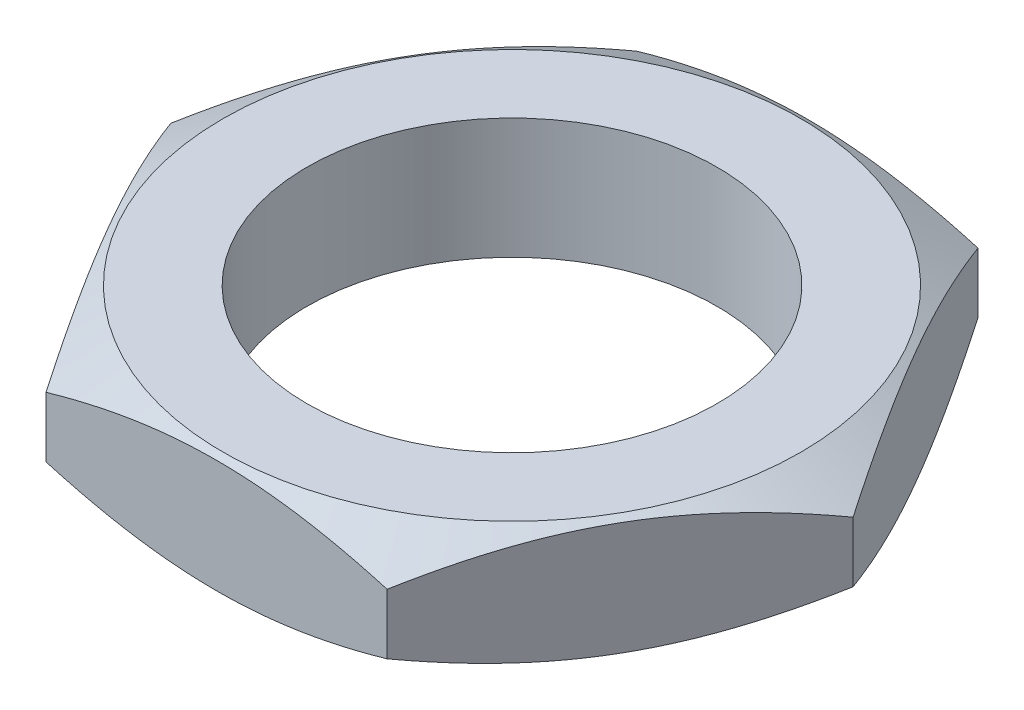
from build123d import *

# Parameters (mm, degrees)
SKETCH1_R           = 3.4
BOSS_EXTRUDE1_DEPTH = 2


with BuildPart() as part:
    # Sketch1 → Boss-Extrude1 (new body)
    with BuildSketch(Plane(origin=(0, 0, 0), x_dir=(1, 0, 0), z_dir=(0, 1, 0))):
        Polygon((5.658032638, 0), (2.829016319, 4.9), (-2.829016319, 4.9), (-5.658032638, 0), (-2.829016319, -4.9), (2.829016319, -4.9), align=None)
        with Locations(Location((0, 0, 0), (0, 0, 270))):
            Circle(SKETCH1_R, mode=Mode.SUBTRACT)
    extrude(amount=BOSS_EXTRUDE1_DEPTH)

    # Sketch2 → Cut-Revolve1 (revolve, cut)
    with BuildSketch(Plane.XY):
        Polygon((5.658032638, 1.5), (4.792007234, 2), (5.658032638, 2), align=None)
        Polygon((5.658032638, 0.5), (4.792007234, 0), (5.658032638, 0), align=None)
    revolve(axis=Axis((0, -1000, 0), (0, 1, 0)), mode=Mode.SUBTRACT)


solid = part.part
